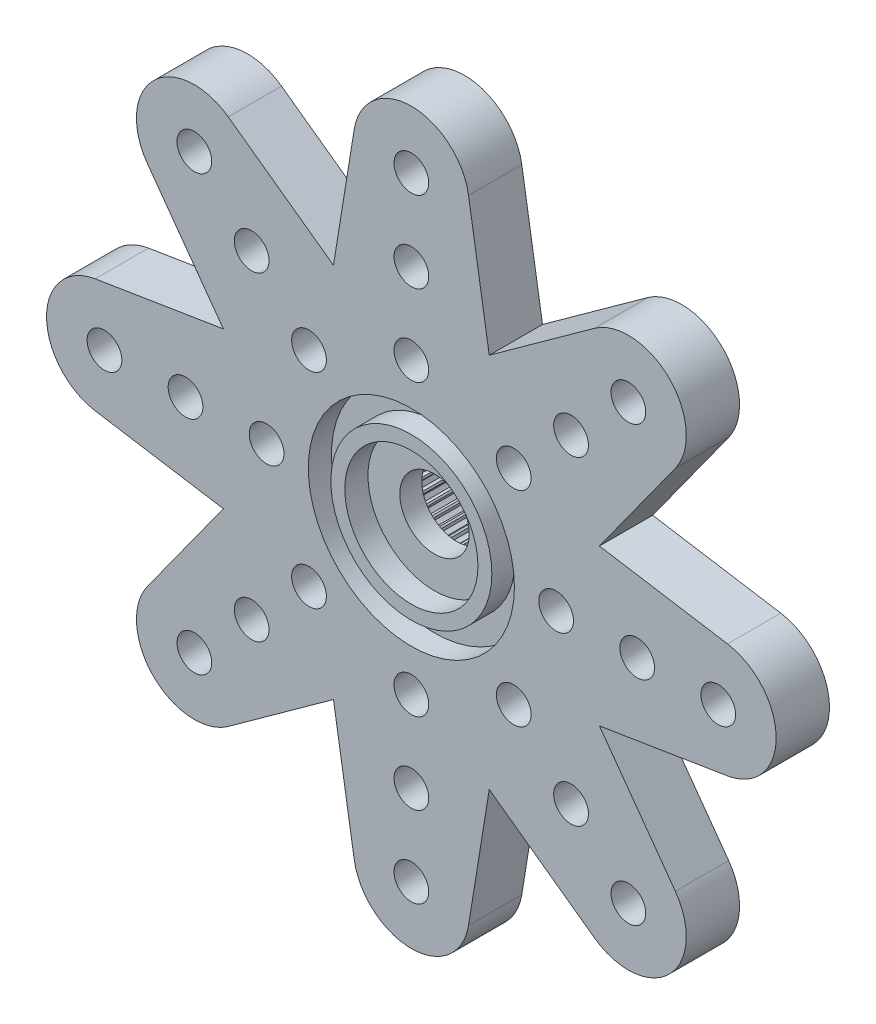
from build123d import *

# Parameters (mm, degrees)
BOSS_EXTRU_1_DEPTH      = 2.3
ESQUISSE2_R             = 4.45
ENL_V_MAT_EXTRU_1_DEPTH = 1
ESQUISSE3_R             = 3.475
ESQUISSE3_R_2           = 2.875
BOSS_EXTRU_2_DEPTH      = 1
ESQUISSE4_R             = 4.4
BOSS_EXTRU_3_DEPTH      = 3
ESQUISSE5_R             = 1.5
ENL_V_MAT_EXTRU_2_DEPTH = 23.685127286
ENL_V_START             = -3.35
ESQUISSE6_R             = 1.5
ENL_V_MAT_EXTRU_3_DEPTH = 3.35
ESQUISSE7_R             = 0.75
ENL_V_MAT_EXTRU_4_DEPTH = 3.35


with BuildPart() as part:
    # Esquisse1 → Boss.-Extru.1 (new body)
    with BuildSketch(Plane.XY):
        with BuildLine():
            Line((-13.649264321, 2.467911668), (-8.118323608, 3.362719742))
            Line((-8.118323608, 3.362719742), (-11.396564435, 7.906410283))
            ThreePointArc((-11.396564435, 7.906410283), (-11.136931804, 11.136931804), (-7.906410283, 11.396564435))
            Line((-7.906410283, 11.396564435), (-3.362719742, 8.118323608))
            Line((-3.362719742, 8.118323608), (-2.467911668, 13.649264321))
            ThreePointArc((-2.467911668, 13.649264321), (0, 15.75), (2.467911668, 13.649264321))
            Line((2.467911668, 13.649264321), (3.362719742, 8.118323608))
            Line((3.362719742, 8.118323608), (7.906410283, 11.396564435))
            ThreePointArc((7.906410283, 11.396564435), (11.136931804, 11.136931804), (11.396564435, 7.906410283))
            Line((11.396564435, 7.906410283), (8.118323608, 3.362719742))
            Line((8.118323608, 3.362719742), (13.649264321, 2.467911668))
            ThreePointArc((13.649264321, 2.467911668), (15.75, 0), (13.649264321, -2.467911668))
            Line((13.649264321, -2.467911668), (8.118323608, -3.362719742))
            Line((8.118323608, -3.362719742), (11.396564435, -7.906410283))
            ThreePointArc((11.396564435, -7.906410283), (11.136931804, -11.136931804), (7.906410283, -11.396564435))
            Line((7.906410283, -11.396564435), (3.362719742, -8.118323608))
            Line((3.362719742, -8.118323608), (2.467911668, -13.649264321))
            ThreePointArc((2.467911668, -13.649264321), (0, -15.75), (-2.467911668, -13.649264321))
            Line((-2.467911668, -13.649264321), (-3.362719742, -8.118323608))
            Line((-3.362719742, -8.118323608), (-7.906410283, -11.396564435))
            ThreePointArc((-7.906410283, -11.396564435), (-11.136931804, -11.136931804), (-11.396564435, -7.906410283))
            Line((-11.396564435, -7.906410283), (-8.118323608, -3.362719742))
            Line((-8.118323608, -3.362719742), (-13.649264321, -2.467911668))
            ThreePointArc((-13.649264321, -2.467911668), (-15.75, 0), (-13.649264321, 2.467911668))
        make_face()
    extrude(amount=BOSS_EXTRU_1_DEPTH)

    # Esquisse2 → Enlèv. mat.-Extru.1 (cut)
    with BuildSketch(Plane.XY.offset(2.3)):
        Circle(ESQUISSE2_R)
    extrude(amount=-ENL_V_MAT_EXTRU_1_DEPTH, mode=Mode.SUBTRACT)

    # Esquisse3 → Boss.-Extru.2 (add)
    with BuildSketch(Plane.XY.offset(1.3)):
        Circle(ESQUISSE3_R)
        Circle(ESQUISSE3_R_2, mode=Mode.SUBTRACT)
    extrude(amount=BOSS_EXTRU_2_DEPTH)

    # Esquisse4 → Boss.-Extru.3 (add)
    with BuildSketch(Plane(origin=(0, 0, 0), x_dir=(-1, 0, 0), z_dir=(0, 0, -1))):
        with Locations(Location((0, 0, 0), (0, 0, 180))):
            Circle(ESQUISSE4_R)
    extrude(amount=BOSS_EXTRU_3_DEPTH)

    # Esquisse5 → Enlèv. mat.-Extru.2 (cut, through all)
    with BuildSketch(Plane.XY.offset(1.3)):
        Circle(ESQUISSE5_R)
    extrude(amount=-ENL_V_MAT_EXTRU_2_DEPTH, mode=Mode.SUBTRACT)

    # Esquisse6 → Enlèv. mat.-Extru.3 (cut)
    with BuildSketch(Plane(origin=(0, 0, -3), x_dir=(-1, 0, 0), z_dir=(0, 0, -1)).offset(ENL_V_START)):
        with BuildLine():
            Line((-0.040605305, 2.865160176), (-0.114276657, 2.997822684))
            ThreePointArc((-0.114276657, 2.997822684), (-0.209269421, 2.992692151), (-0.304051754, 2.984552317))
            Line((-0.304051754, 2.984552317), (-0.35854309, 2.8429278))
            Line((-0.35854309, 2.8429278), (-0.438963363, 2.831625467))
            Line((-0.438963363, 2.831625467), (-0.530380804, 2.952743843))
            ThreePointArc((-0.530380804, 2.952743843), (-0.623735072, 2.934442802), (-0.716462144, 2.913191033))
            Line((-0.716462144, 2.913191033), (-0.750712851, 2.765361068))
            Line((-0.750712851, 2.765361068), (-0.828777499, 2.742976391))
            Line((-0.828777499, 2.742976391), (-0.936161691, 2.850193202))
            ThreePointArc((-0.936161691, 2.850193202), (-1.02606043, 2.819077862), (-1.114927414, 2.7851278))
            Line((-1.114927414, 2.7851278), (-1.12827084, 2.633969729))
            Line((-1.12827084, 2.633969729), (-1.202460424, 2.600938398))
            Line((-1.202460424, 2.600938398), (-1.323721256, 2.692166792))
            ThreePointArc((-1.323721256, 2.692166792), (-1.408414688, 2.648842779), (-1.491691889, 2.602855222))
            Line((-1.491691889, 2.602855222), (-1.483868321, 2.451311165))
            Line((-1.483868321, 2.451311165), (-1.552738824, 2.408276099))
            Line((-1.552738824, 2.408276099), (-1.685516093, 2.481740418))
            ThreePointArc((-1.685516093, 2.481740418), (-1.763355757, 2.427050983), (-1.839422279, 2.369921028))
            Line((-1.839422279, 2.369921028), (-1.810583992, 2.220940618))
            Line((-1.810583992, 2.220940618), (-1.872794929, 2.168739444))
            Line((-1.872794929, 2.168739444), (-2.014504276, 2.223009789))
            ThreePointArc((-2.014504276, 2.223009789), (-2.083975111, 2.158019401), (-2.151350406, 2.090859017))
            Line((-2.151350406, 2.090859017), (-2.102058706, 1.947341988))
            Line((-2.102058706, 1.947341988), (-2.156399211, 1.886990743))
            Line((-2.156399211, 1.886990743), (-2.304282424, 1.921010804))
            ThreePointArc((-2.304282424, 1.921010804), (-2.364032261, 1.846984426), (-2.421404945, 1.771100813))
            Line((-2.421404945, 1.771100813), (-2.352619239, 1.635840561))
            Line((-2.352619239, 1.635840561), (-2.398031635, 1.568513914))
            Line((-2.398031635, 1.568513914), (-2.549210337, 1.581621528))
            ThreePointArc((-2.549210337, 1.581621528), (-2.598076211, 1.5), (-2.644329591, 1.416870147))
            Line((-2.644329591, 1.416870147), (-2.557388713, 1.292499358))
            Line((-2.557388713, 1.292499358), (-2.592989102, 1.219507746))
            Line((-2.592989102, 1.219507746), (-2.74452077, 1.211447789))
            ThreePointArc((-2.74452077, 1.211447789), (-2.781551564, 1.12381978), (-2.815785369, 1.035061715))
            Line((-2.815785369, 1.035061715), (-2.712381526, 0.924001126))
            Line((-2.712381526, 0.924001126), (-2.737476984, 0.846765246))
            Line((-2.737476984, 0.846765246), (-2.886412228, 0.817694596))
            ThreePointArc((-2.886412228, 0.817694596), (-2.910887179, 0.725765687), (-2.932435088, 0.633106984))
            Line((-2.932435088, 0.633106984), (-2.814580917, 0.537518262))
            Line((-2.814580917, 0.537518262), (-2.828682992, 0.457541424))
            Line((-2.828682992, 0.457541424), (-2.972122955, 0.408025908))
            ThreePointArc((-2.972122955, 0.408025908), (-2.983565686, 0.31358539), (-2.992008294, 0.218829546))
            Line((-2.992008294, 0.218829546), (-2.861997693, 0.140573217))
            Line((-2.861997693, 0.140573217), (-2.864831902, 0.059412079))
            Line((-2.864831902, 0.059412079), (-2.999984689, -0.00958454))
            ThreePointArc((-2.999984689, -0.00958454), (-2.998172481, -0.10469849), (-2.993345461, -0.19970716))
            Line((-2.993345461, -0.19970716), (-2.853708938, -0.259107925))
            Line((-2.853708938, -0.259107925), (-2.845220118, -0.339873655))
            Line((-2.845220118, -0.339873655), (-2.969455134, -0.427008436))
            ThreePointArc((-2.969455134, -0.427008436), (-2.954423259, -0.520944533), (-2.936420564, -0.614356794))
            Line((-2.936420564, -0.614356794), (-2.789875986, -0.653745827))
            Line((-2.789875986, -0.653745827), (-2.770229361, -0.732544135))
            Line((-2.770229361, -0.732544135), (-2.881128513, -0.836121099))
            ThreePointArc((-2.881128513, -0.836121099), (-2.853169549, -0.927050983), (-2.822341581, -1.017048672))
            Line((-2.822341581, -1.017048672), (-2.67174127, -1.03565931))
            Line((-2.67174127, -1.03565931), (-2.641319241, -1.110956476))
            Line((-2.641319241, -1.110956476), (-2.736724002, -1.228959615))
            ThreePointArc((-2.736724002, -1.228959615), (-2.696382139, -1.31511344), (-2.653328929, -1.399944854))
            Line((-2.653328929, -1.399944854), (-2.50160415, -1.397414862))
            Line((-2.50160415, -1.397414862), (-2.460998845, -1.467745313))
            Line((-2.460998845, -1.467745313), (-2.539052272, -1.59787783))
            ThreePointArc((-2.539052272, -1.59787783), (-2.487112718, -1.67757871), (-2.432672248, -1.755592702))
            Line((-2.432672248, -1.755592702), (-2.282776151, -1.731971324))
            Line((-2.282776151, -1.731971324), (-2.232777907, -1.795966158))
            Line((-2.232777907, -1.795966158), (-2.291960777, -1.935695171))
            ThreePointArc((-2.291960777, -1.935695171), (-2.229434476, -2.007391819), (-2.164666369, -2.077069935))
            Line((-2.164666369, -2.077069935), (-2.019516511, -2.032816934))
            Line((-2.019516511, -2.032816934), (-1.961098487, -2.089230564))
            Line((-1.961098487, -2.089230564), (-2.000258873, -2.235836408))
            ThreePointArc((-2.000258873, -2.235836408), (-1.928362829, -2.298133329), (-1.854527721, -2.358119364))
            Line((-1.854527721, -2.358119364), (-1.716949278, -2.294096074))
            Line((-1.716949278, -2.294096074), (-1.651248515, -2.341830473))
            Line((-1.651248515, -2.341830473), (-1.669624205, -2.492459631))
            ThreePointArc((-1.669624205, -2.492459631), (-1.589757793, -2.544144288), (-1.5082928, -2.593270682))
            Line((-1.5082928, -2.593270682), (-1.380963581, -2.510723244))
            Line((-1.380963581, -2.510723244), (-1.309258869, -2.548849316))
            Line((-1.309258869, -2.548849316), (-1.306492201, -2.700569964))
            ThreePointArc((-1.306492201, -2.700569964), (-1.220209929, -2.740636373), (-1.132700676, -2.777946936))
            Line((-1.132700676, -2.777946936), (-1.018098999, -2.678482042))
            Line((-1.018098999, -2.678482042), (-0.941785989, -2.706257707))
            Line((-0.941785989, -2.706257707), (-0.917930812, -2.856116773))
            ThreePointArc((-0.917930812, -2.856116773), (-0.826912067, -2.883785088), (-0.735061821, -2.908553613))
            Line((-0.735061821, -2.908553613), (-0.635418278, -2.794107234))
            Line((-0.635418278, -2.794107234), (-0.555982315, -2.810991869))
            Line((-0.555982315, -2.810991869), (-0.511502945, -2.956072519))
            ThreePointArc((-0.511502945, -2.956072519), (-0.417519303, -2.970804206), (-0.323115824, -2.982548602))
            Line((-0.323115824, -2.982548602), (-0.240369863, -2.855348306))
            Line((-0.240369863, -2.855348306), (-0.159357078, -2.861013272))
            Line((-0.159357078, -2.861013272), (-0.095119254, -2.998491675))
            ThreePointArc((-0.095119254, -2.998491675), (0, -3), (0.095119254, -2.998491675))
            Line((0.095119254, -2.998491675), (0.159357078, -2.861013272))
            Line((0.159357078, -2.861013272), (0.240369863, -2.855348306))
            Line((0.240369863, -2.855348306), (0.323115824, -2.982548602))
            ThreePointArc((0.323115824, -2.982548602), (0.417519303, -2.970804206), (0.511502945, -2.956072519))
            Line((0.511502945, -2.956072519), (0.555982315, -2.810991869))
            Line((0.555982315, -2.810991869), (0.635418278, -2.794107234))
            Line((0.635418278, -2.794107234), (0.735061821, -2.908553613))
            ThreePointArc((0.735061821, -2.908553613), (0.826912067, -2.883785088), (0.917930812, -2.856116773))
            Line((0.917930812, -2.856116773), (0.941785989, -2.706257707))
            Line((0.941785989, -2.706257707), (1.018098999, -2.678482042))
            Line((1.018098999, -2.678482042), (1.132700676, -2.777946936))
            ThreePointArc((1.132700676, -2.777946936), (1.220209929, -2.740636373), (1.306492201, -2.700569964))
            Line((1.306492201, -2.700569964), (1.309258869, -2.548849316))
            Line((1.309258869, -2.548849316), (1.380963581, -2.510723244))
            Line((1.380963581, -2.510723244), (1.5082928, -2.593270682))
            ThreePointArc((1.5082928, -2.593270682), (1.589757793, -2.544144288), (1.669624205, -2.492459631))
            Line((1.669624205, -2.492459631), (1.651248515, -2.341830473))
            Line((1.651248515, -2.341830473), (1.716949278, -2.294096074))
            Line((1.716949278, -2.294096074), (1.854527721, -2.358119364))
            ThreePointArc((1.854527721, -2.358119364), (1.928362829, -2.298133329), (2.000258873, -2.235836408))
            Line((2.000258873, -2.235836408), (1.961098487, -2.089230564))
            Line((1.961098487, -2.089230564), (2.019516511, -2.032816934))
            Line((2.019516511, -2.032816934), (2.164666369, -2.077069935))
            ThreePointArc((2.164666369, -2.077069935), (2.229434476, -2.007391819), (2.291960777, -1.935695171))
            Line((2.291960777, -1.935695171), (2.232777907, -1.795966158))
            Line((2.232777907, -1.795966158), (2.282776151, -1.731971324))
            Line((2.282776151, -1.731971324), (2.432672248, -1.755592702))
            ThreePointArc((2.432672248, -1.755592702), (2.487112718, -1.67757871), (2.539052272, -1.59787783))
            Line((2.539052272, -1.59787783), (2.460998845, -1.467745313))
            Line((2.460998845, -1.467745313), (2.50160415, -1.397414862))
            Line((2.50160415, -1.397414862), (2.653328929, -1.399944854))
            ThreePointArc((2.653328929, -1.399944854), (2.696382139, -1.31511344), (2.736724002, -1.228959615))
            Line((2.736724002, -1.228959615), (2.641319241, -1.110956476))
            Line((2.641319241, -1.110956476), (2.67174127, -1.03565931))
            Line((2.67174127, -1.03565931), (2.822341581, -1.017048672))
            ThreePointArc((2.822341581, -1.017048672), (2.853169549, -0.927050983), (2.881128513, -0.836121099))
            Line((2.881128513, -0.836121099), (2.770229361, -0.732544135))
            Line((2.770229361, -0.732544135), (2.789875986, -0.653745827))
            Line((2.789875986, -0.653745827), (2.936420564, -0.614356794))
            ThreePointArc((2.936420564, -0.614356794), (2.954423259, -0.520944533), (2.969455134, -0.427008436))
            Line((2.969455134, -0.427008436), (2.845220118, -0.339873655))
            Line((2.845220118, -0.339873655), (2.853708938, -0.259107925))
            Line((2.853708938, -0.259107925), (2.993345461, -0.19970716))
            ThreePointArc((2.993345461, -0.19970716), (2.998172481, -0.10469849), (2.999984689, -0.00958454))
            Line((2.999984689, -0.00958454), (2.864831902, 0.059412079))
            Line((2.864831902, 0.059412079), (2.861997693, 0.140573217))
            Line((2.861997693, 0.140573217), (2.992008294, 0.218829546))
            ThreePointArc((2.992008294, 0.218829546), (2.983565686, 0.31358539), (2.972122955, 0.408025908))
            Line((2.972122955, 0.408025908), (2.828682992, 0.457541424))
            Line((2.828682992, 0.457541424), (2.814580917, 0.537518262))
            Line((2.814580917, 0.537518262), (2.932435088, 0.633106984))
            ThreePointArc((2.932435088, 0.633106984), (2.910887179, 0.725765687), (2.886412228, 0.817694596))
            Line((2.886412228, 0.817694596), (2.737476984, 0.846765246))
            Line((2.737476984, 0.846765246), (2.712381526, 0.924001126))
            Line((2.712381526, 0.924001126), (2.815785369, 1.035061715))
            ThreePointArc((2.815785369, 1.035061715), (2.781551564, 1.12381978), (2.74452077, 1.211447789))
            Line((2.74452077, 1.211447789), (2.592989102, 1.219507746))
            Line((2.592989102, 1.219507746), (2.557388713, 1.292499358))
            Line((2.557388713, 1.292499358), (2.644329591, 1.416870147))
            ThreePointArc((2.644329591, 1.416870147), (2.598076211, 1.5), (2.549210337, 1.581621528))
            Line((2.549210337, 1.581621528), (2.398031635, 1.568513914))
            Line((2.398031635, 1.568513914), (2.352619239, 1.635840561))
            Line((2.352619239, 1.635840561), (2.421404945, 1.771100813))
            ThreePointArc((2.421404945, 1.771100813), (2.364032261, 1.846984426), (2.304282424, 1.921010804))
            Line((2.304282424, 1.921010804), (2.156399211, 1.886990743))
            Line((2.156399211, 1.886990743), (2.102058706, 1.947341988))
            Line((2.102058706, 1.947341988), (2.151350406, 2.090859017))
            ThreePointArc((2.151350406, 2.090859017), (2.083975111, 2.158019401), (2.014504276, 2.223009789))
            Line((2.014504276, 2.223009789), (1.872794929, 2.168739444))
            Line((1.872794929, 2.168739444), (1.810583992, 2.220940618))
            Line((1.810583992, 2.220940618), (1.839422279, 2.369921028))
            ThreePointArc((1.839422279, 2.369921028), (1.763355757, 2.427050983), (1.685516093, 2.481740418))
            Line((1.685516093, 2.481740418), (1.552738824, 2.408276099))
            Line((1.552738824, 2.408276099), (1.483868321, 2.451311165))
            Line((1.483868321, 2.451311165), (1.491691889, 2.602855222))
            ThreePointArc((1.491691889, 2.602855222), (1.408414688, 2.648842779), (1.323721256, 2.692166792))
            Line((1.323721256, 2.692166792), (1.202460424, 2.600938398))
            Line((1.202460424, 2.600938398), (1.12827084, 2.633969729))
            Line((1.12827084, 2.633969729), (1.114927414, 2.7851278))
            ThreePointArc((1.114927414, 2.7851278), (1.02606043, 2.819077862), (0.936161691, 2.850193202))
            Line((0.936161691, 2.850193202), (0.828777499, 2.742976391))
            Line((0.828777499, 2.742976391), (0.750712851, 2.765361068))
            Line((0.750712851, 2.765361068), (0.716462144, 2.913191033))
            ThreePointArc((0.716462144, 2.913191033), (0.623735072, 2.934442802), (0.530380804, 2.952743843))
            Line((0.530380804, 2.952743843), (0.438963363, 2.831625467))
            Line((0.438963363, 2.831625467), (0.35854309, 2.8429278))
            Line((0.35854309, 2.8429278), (0.304051754, 2.984552317))
            ThreePointArc((0.304051754, 2.984552317), (0.209269421, 2.992692151), (0.114276657, 2.997822684))
            Line((0.114276657, 2.997822684), (0.040605305, 2.865160176))
            Line((0.040605305, 2.865160176), (-0.040605305, 2.865160176))
        make_face()
        with Locations(Location((0, 0, 0), (0, 0, 180))):
            Circle(ESQUISSE6_R, mode=Mode.SUBTRACT)
    extrude(amount=ENL_V_MAT_EXTRU_3_DEPTH, mode=Mode.SUBTRACT)

    # Esquisse7 → Enlèv. mat.-Extru.4 (cut)
    with BuildSketch(Plane.XY.offset(2.3)):
        with Locations((-13.25, 0)):
            Circle(ESQUISSE7_R)
        with Locations((-9.75, 0)):
            Circle(ESQUISSE7_R)
        with Locations((-9.369164851, 9.369164851)):
            Circle(ESQUISSE7_R)
        with Locations((-6.25, 0)):
            Circle(ESQUISSE7_R)
        with Locations((-6.894291117, 6.894291117)):
            Circle(ESQUISSE7_R)
        with Locations((-4.419417382, 4.419417382)):
            Circle(ESQUISSE7_R)
        with Locations((0, 13.25)):
            Circle(ESQUISSE7_R)
        with Locations((0, 9.75)):
            Circle(ESQUISSE7_R)
        with Locations((0, 6.25)):
            Circle(ESQUISSE7_R)
        with Locations((9.369164851, 9.369164851)):
            Circle(ESQUISSE7_R)
        with Locations((6.894291117, 6.894291117)):
            Circle(ESQUISSE7_R)
        with Locations((4.419417382, 4.419417382)):
            Circle(ESQUISSE7_R)
        with Locations((13.25, 0)):
            Circle(ESQUISSE7_R)
        with Locations((9.75, 0)):
            Circle(ESQUISSE7_R)
        with Locations((6.25, 0)):
            Circle(ESQUISSE7_R)
        with Locations((9.369164851, -9.369164851)):
            Circle(ESQUISSE7_R)
        with Locations((6.894291117, -6.894291117)):
            Circle(ESQUISSE7_R)
        with Locations((4.419417382, -4.419417382)):
            Circle(ESQUISSE7_R)
        with Locations((0, -13.25)):
            Circle(ESQUISSE7_R)
        with Locations((0, -9.75)):
            Circle(ESQUISSE7_R)
        with Locations((0, -6.25)):
            Circle(ESQUISSE7_R)
        with Locations((-9.369164851, -9.369164851)):
            Circle(ESQUISSE7_R)
        with Locations((-6.894291117, -6.894291117)):
            Circle(ESQUISSE7_R)
        with Locations((-4.419417382, -4.419417382)):
            Circle(ESQUISSE7_R)
    extrude(amount=-ENL_V_MAT_EXTRU_4_DEPTH, mode=Mode.SUBTRACT)


solid = part.part
